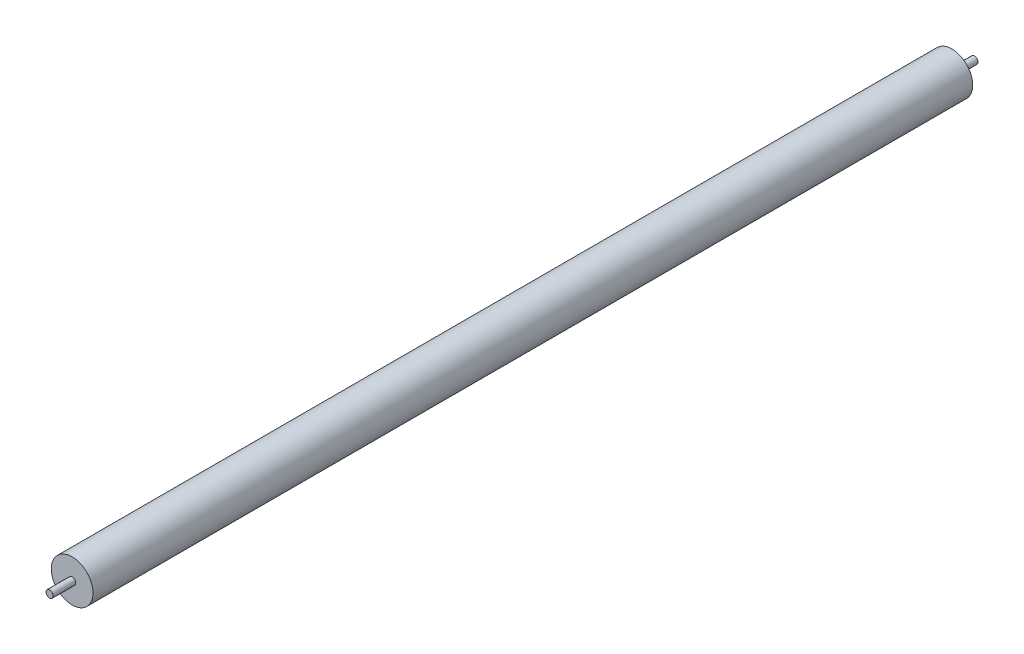
from build123d import *

# Parameters (mm, degrees)
SKETCH1_R           = 18.5
BOSS_EXTRUDE1_DEPTH = 390
SKETCH2_R           = 3.175
BOSS_EXTRUDE2_DEPTH = 410


with BuildPart() as part:
    # Sketch1 → Boss-Extrude1 (new, symmetric)
    with BuildSketch(Plane.XY):
        Circle(SKETCH1_R)
    extrude(amount=BOSS_EXTRUDE1_DEPTH, both=True)

    # Sketch2 → Boss-Extrude2 (add, symmetric)
    with BuildSketch(Plane.XY):
        with Locations(Location((0, 0, 0), (0, 0, 180))):
            Circle(SKETCH2_R)
    extrude(amount=BOSS_EXTRUDE2_DEPTH, both=True)


solid = part.part
